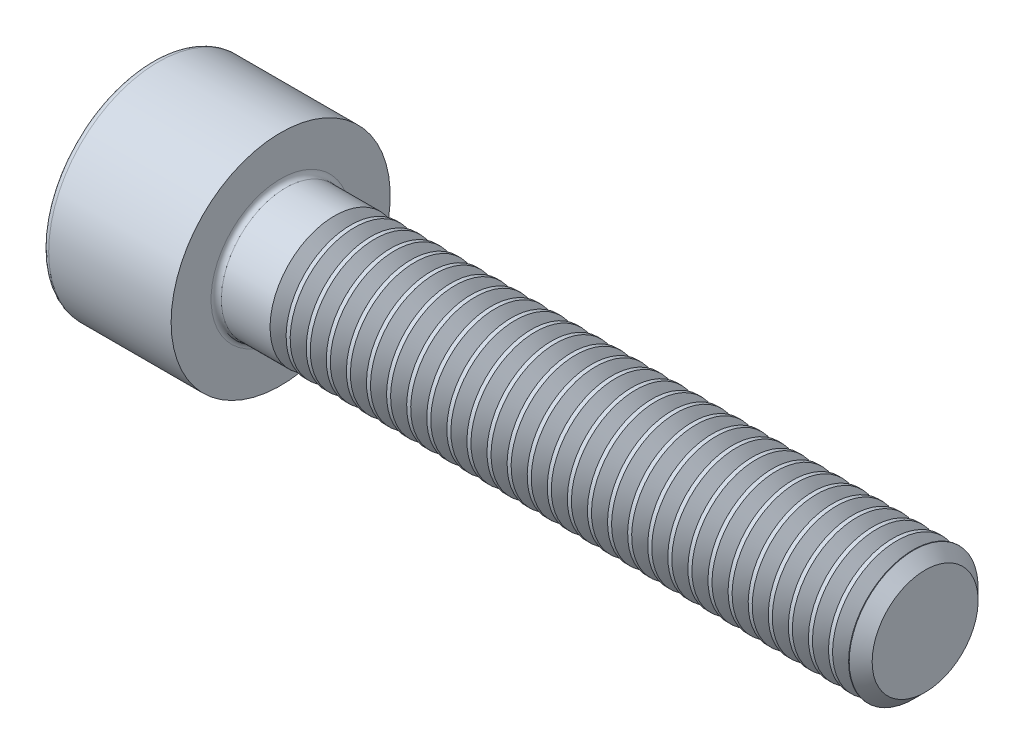
from build123d import *

# Parameters (mm, degrees)
FILLET1_R       = 0.2
FILLET2_R       = 0.25
HEX_2_DEPTH     = 2.5
THDSCHPAT_COUNT = 29
THDSCHPAT_PITCH = 0.779310345


with BuildPart() as part:
    # BodySke → Base-Revolve (revolve)
    with BuildSketch(Plane.XY, mode=Mode.PRIVATE) as base_revolve_sk:
        Polygon((0, 0), (0, 4.25), (5, 4.25), (5, 2.5), (29.555, 2.5), (30, 2.055), (30, 0), align=None)
    revolve(base_revolve_sk.sketch.rotate(Axis((-31.75, 0, 0), (1, 0, 0)), 90), axis=Axis((-31.75, 0, 0), (1, 0, 0)))

    # Fillet1
    fillet1_edges = [part.edges().sort_by_distance(p)[0] for p in [
        (5, 0, -2.5),
    ]]
    fillet(fillet1_edges, radius=FILLET1_R)

    # Fillet2
    fillet2_edges = [part.edges().sort_by_distance(p)[0] for p in [
        (0, 0, -4.25),
    ]]
    fillet(fillet2_edges, radius=FILLET2_R)

    # Sketch2 → Hex-PreBroach (revolve, cut)
    with BuildSketch(Plane.XY, mode=Mode.PRIVATE) as hex_prebroach_sk:
        Polygon((0, 2.042), (2.5, 2.042), (3.67894925, 0), (0, 0), align=None)
    revolve(hex_prebroach_sk.sketch.rotate(Axis((0, 0, 0), (1, 0, 0)), 90), axis=Axis((0, 0, 0), (1, 0, 0)), mode=Mode.SUBTRACT)

    # Sketch3 → Hex 2 (cut)
    with BuildSketch(Plane(origin=(0, 0, 0), x_dir=(0, 0.500000000000001, 0.866025403784438), z_dir=(-1, 0, 0))):
        Polygon((1.17894925, 2.042), (-1.17894925, 2.042), (-2.357898499, 0), (-1.17894925, -2.042), (1.17894925, -2.042), (2.357898499, 0), align=None)
    extrude(amount=-HEX_2_DEPTH, mode=Mode.SUBTRACT)

    # ThdSchSke → ThreadSchematic (revolve, cut)
    with BuildSketch(Plane.XY):
        Polygon((7.4, -2.055), (7.088407645, -2.5), (7.088407645, -3.125), (7.711592355, -3.125), (7.711592355, -2.5), align=None)
    threadschematic = revolve(axis=Axis((-3.175, 0, 0), (1, 0, 0)), mode=Mode.SUBTRACT)

    # ThdSchPat: ThreadSchematic ×29
    with Locations(*[(i * THDSCHPAT_PITCH, 0, 0) for i in range(1, THDSCHPAT_COUNT)]):
        add(threadschematic, mode=Mode.SUBTRACT)


solid = part.part
